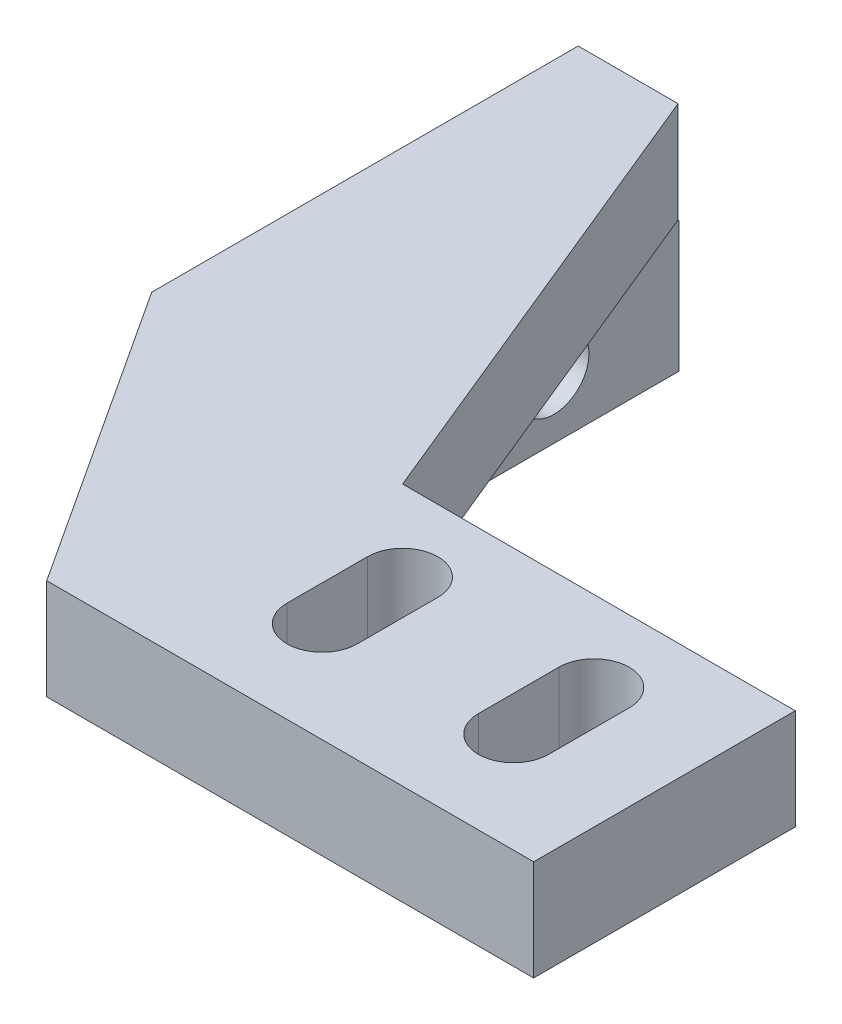
from build123d import *

# Parameters (mm, degrees)
ESTRUSIONE_ESTRUSIONE8_DEPTH = 5
SCHIZZO19_W                  = 5
SCHIZZO19_H                  = 36.212351189
ESTRUSIONE_ESTRUSIONE9_DEPTH = 6.5
SCHIZZO20_R                  = 1.75
TAGLIO_ESTRUSIONE9_DEPTH     = 6
TAGLIO_ESTRUSIONE13_DEPTH    = 21
SCHIZZO26_W                  = 5
SCHIZZO26_H                  = 6.5
TAGLIO_ESTRUSIONE15_DEPTH    = 21


with BuildPart() as part:
    # Schizzo18 → Estrusione-Estrusione8 (new body)
    with BuildSketch(Plane(origin=(0, 40, 0), x_dir=(1, 0, 0), z_dir=(0, 1, 0))):
        Polygon((25, -16), (-9, -16), (-9, 20.212351189), (-4.036856652, 20.212351189), (5.487873038, -3), (25, -3), align=None)
        with BuildLine():
            Line((17.25, -11), (17.25, -7))
            ThreePointArc((17.25, -7), (19, -5.25), (20.75, -7))
            Line((20.75, -7), (20.75, -11))
            ThreePointArc((20.75, -11), (19, -12.75), (17.25, -11))
        make_face(mode=Mode.SUBTRACT)
        with BuildLine():
            Line((7.74056589, -11), (7.74056589, -7))
            ThreePointArc((7.74056589, -7), (9.49056589, -5.25), (11.24056589, -7))
            Line((11.24056589, -7), (11.24056589, -11))
            ThreePointArc((11.24056589, -11), (9.49056589, -12.75), (7.74056589, -11))
        make_face(mode=Mode.SUBTRACT)
    extrude(amount=ESTRUSIONE_ESTRUSIONE8_DEPTH)

    # Schizzo19 → Estrusione-Estrusione9 (add)
    with BuildSketch(Plane.XZ.offset(-40)):
        with Locations((-6.5, -2.106175594)):
            Rectangle(SCHIZZO19_W, SCHIZZO19_H)
    extrude(amount=ESTRUSIONE_ESTRUSIONE9_DEPTH)

    # Schizzo20 → Taglio-Estrusione9 (cut)
    with BuildSketch(Plane.ZY.offset(9)):
        with Locations((-14, 36.5)):
            Circle(SCHIZZO20_R)
        with Locations((-4, 36.5)):
            Circle(SCHIZZO20_R)
    extrude(amount=-TAGLIO_ESTRUSIONE9_DEPTH, mode=Mode.SUBTRACT)

    # Schizzo24 → Taglio-Estrusione13 (cut)
    with BuildSketch(Plane(origin=(0, 45, 0), x_dir=(1, 0, 0), z_dir=(0, 1, 0))):
        Polygon((0.805132443, -16), (-9, -0.979024983), (-9, -16), align=None)
    extrude(amount=-TAGLIO_ESTRUSIONE13_DEPTH, mode=Mode.SUBTRACT)

    # Schizzo26 → Taglio-Estrusione15 (cut)
    with BuildSketch(Plane.XY.offset(0.979024983)):
        with Locations((-6.5, 36.75)):
            Rectangle(SCHIZZO26_W, SCHIZZO26_H)
    extrude(amount=TAGLIO_ESTRUSIONE15_DEPTH, mode=Mode.SUBTRACT)


solid = part.part
